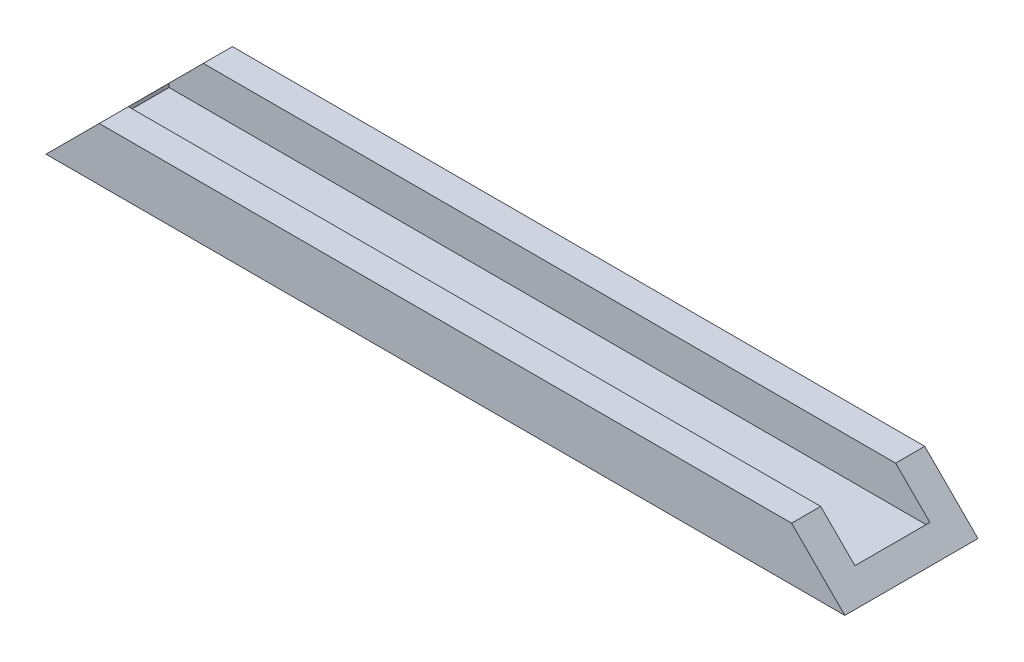
from build123d import *

# Parameters (mm, degrees)
SKETCH1_W          = 133.35
SKETCH1_H          = 22.225
BASE_EXTRUDE_DEPTH = 8.89
SKETCH3_W          = 127
SKETCH3_H          = 12.5095
PIECE_CUT_DEPTH    = 6.35
CORNER_CUT_DEPTH   = 136.481383315


with BuildPart() as part:
    # Sketch1 → Base Extrude (new body)
    with BuildSketch(Plane(origin=(0, 0, 0), x_dir=(1, 0, 0), z_dir=(0, 1, 0))):
        with Locations((66.675, 11.1125)):
            Rectangle(SKETCH1_W, SKETCH1_H)
    extrude(amount=BASE_EXTRUDE_DEPTH)

    # Sketch3 → Piece Cut (cut)
    with BuildSketch(Plane(origin=(0, 8.89, 0), x_dir=(1, 0, 0), z_dir=(0, 1, 0))):
        with Locations((66.675, 11.1125)):
            Rectangle(SKETCH3_W, SKETCH3_H)
    extrude(amount=-PIECE_CUT_DEPTH, mode=Mode.SUBTRACT)

    # Sketch4 → Corner Cut (cut, through all)
    with BuildSketch(Plane(origin=(0, 0, -22.225), x_dir=(-1, 0, 0), z_dir=(0, 0, -1))):
        Polygon((0, 0), (-8.89, 8.89), (0, 8.89), align=None)
        Polygon((-133.35, 8.89), (-124.46, 8.89), (-133.35, 0), align=None)
    extrude(amount=-CORNER_CUT_DEPTH, mode=Mode.SUBTRACT)


solid = part.part
